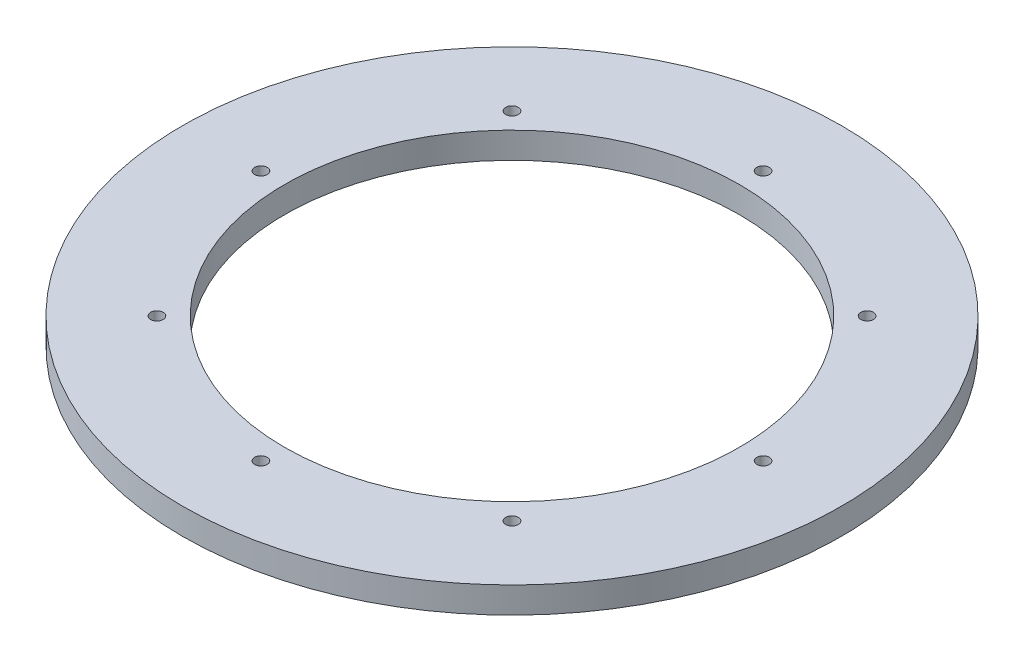
from build123d import *

# Parameters (mm, degrees)
SKETCH1_R           = 315
SKETCH1_R_2         = 217.5
SKETCH1_R_3         = 6
BOSS_EXTRUDE1_DEPTH = 12.5
SKETCH2_R           = 286
SKETCH2_R_2         = 255
CUT_EXTRUDE1_DEPTH  = 12


with BuildPart() as part:
    # Sketch1 → Boss-Extrude1 (new, symmetric)
    with BuildSketch(Plane(origin=(0, 0, 0), x_dir=(1, 0, 0), z_dir=(0, 1, 0))):
        with Locations(Location((0, 0, 0), (0, 0, 270))):
            Circle(SKETCH1_R)
        with Locations(Location((0, 0, 0), (0, 0, 270))):
            Circle(SKETCH1_R_2, mode=Mode.SUBTRACT)
        with Locations(Location((0, 240, 0), (0, 0, 270))):
            Circle(SKETCH1_R_3, mode=Mode.SUBTRACT)
        with Locations(Location((169.705627485, 169.705627485, 0), (0, 0, 270))):
            Circle(SKETCH1_R_3, mode=Mode.SUBTRACT)
        with Locations(Location((240, 0, 0), (0, 0, 270))):
            Circle(SKETCH1_R_3, mode=Mode.SUBTRACT)
        with Locations(Location((169.705627485, -169.705627485, 0), (0, 0, 270))):
            Circle(SKETCH1_R_3, mode=Mode.SUBTRACT)
        with Locations(Location((0, -240, 0), (0, 0, 270))):
            Circle(SKETCH1_R_3, mode=Mode.SUBTRACT)
        with Locations(Location((-169.705627485, -169.705627485, 0), (0, 0, 270))):
            Circle(SKETCH1_R_3, mode=Mode.SUBTRACT)
        with Locations(Location((-240, 0, 0), (0, 0, 270))):
            Circle(SKETCH1_R_3, mode=Mode.SUBTRACT)
        with Locations(Location((-169.705627485, 169.705627485, 0), (0, 0, 270))):
            Circle(SKETCH1_R_3, mode=Mode.SUBTRACT)
    extrude(amount=BOSS_EXTRUDE1_DEPTH, both=True)

    # Sketch2 → Cut-Extrude1 (cut)
    with BuildSketch(Plane.XZ.offset(12.5)):
        with Locations(Location((0, 0, 0), (0, 0, 270))):
            Circle(SKETCH2_R)
        with Locations(Location((0, 0, 0), (0, 0, 270))):
            Circle(SKETCH2_R_2, mode=Mode.SUBTRACT)
    extrude(amount=-CUT_EXTRUDE1_DEPTH, mode=Mode.SUBTRACT)


solid = part.part
